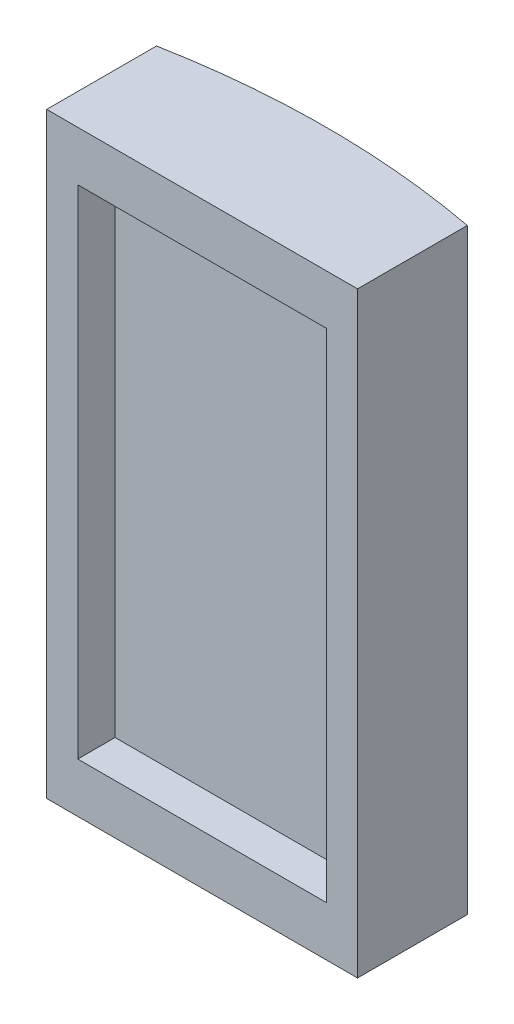
from build123d import *

# Parameters (mm, degrees)
SKETCH1_W           = 25
SKETCH1_H           = 48
BOSS_EXTRUDE1_DEPTH = 10
BOSS_EXTRUDE2_DEPTH = 48
SKETCH4_W           = 17.037497091
SKETCH4_H           = 48
CUT_EXTRUDE1_DEPTH  = 48
SKETCH5_W           = 20
SKETCH5_H           = 40
CUT_EXTRUDE2_DEPTH  = 3


with BuildPart() as part:
    # Sketch1 → Boss-Extrude1 (new body)
    with BuildSketch(Plane.XY):
        with Locations((12.5, 24)):
            Rectangle(SKETCH1_W, SKETCH1_H)
    extrude(amount=BOSS_EXTRUDE1_DEPTH)

    # Sketch3 → Boss-Extrude2 (add)
    with BuildSketch(Plane(origin=(0, 48, 0), x_dir=(1, 0, 0), z_dir=(0, 1, 0))):
        with BuildLine():
            Line((0, -1.170858034), (0, -10))
            Line((0, -10), (25, -10))
            Line((25, -10), (25, -1.170858034))
            ThreePointArc((25, -1.170858034), (12.5, 0), (0, -1.170858034))
        make_face()
    extrude(amount=BOSS_EXTRUDE2_DEPTH)

    # Sketch4 → Cut-Extrude1 (cut)
    with BuildSketch(Plane(origin=(25, 0, 0), x_dir=(0, 0, -1), z_dir=(1, 0, 0))):
        with Locations((-8.518748546, 24)):
            Rectangle(SKETCH4_W, SKETCH4_H)
    extrude(amount=-CUT_EXTRUDE1_DEPTH, mode=Mode.SUBTRACT)

    # Sketch5 → Cut-Extrude2 (cut)
    with BuildSketch(Plane.XY.offset(10)):
        with Locations((12.5, 72)):
            Rectangle(SKETCH5_W, SKETCH5_H)
    extrude(amount=-CUT_EXTRUDE2_DEPTH, mode=Mode.SUBTRACT)


solid = part.part
